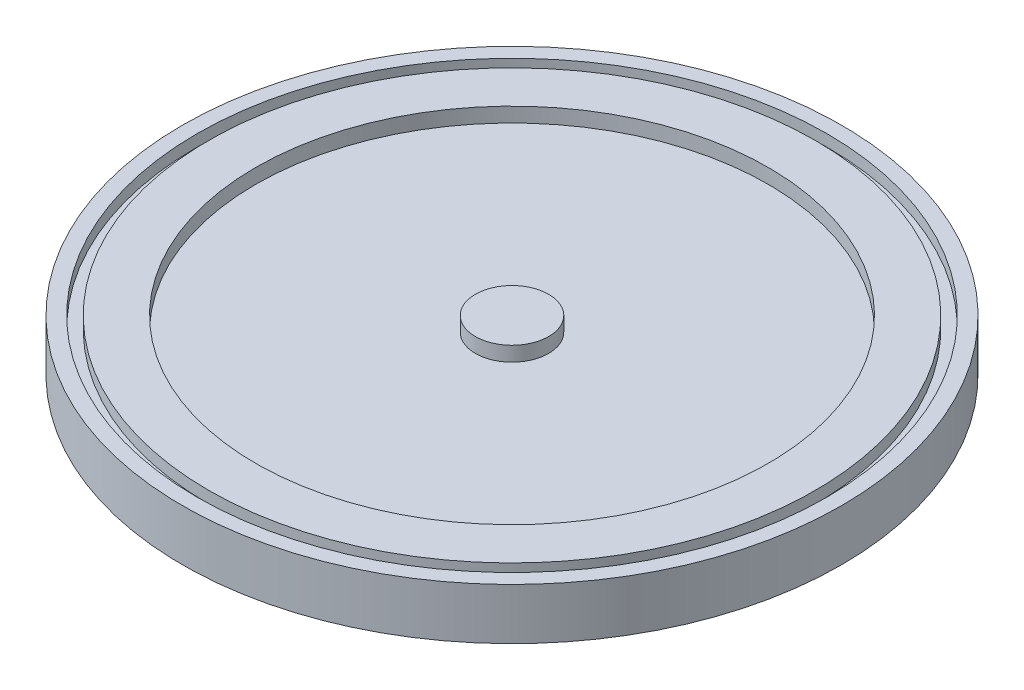
from build123d import *

# Parameters (mm, degrees)
O_RINGS_PROFILE_W = 2.032
O_RINGS_PROFILE_H = 2.032


with BuildPart() as part:
    # Main Shape Profile → Main Shape (revolve)
    with BuildSketch(Plane.XY, mode=Mode.PRIVATE) as main_shape_sk:
        Polygon((57.15, 0), (57.15, 8.89), (44.45, 8.89), (44.45, 6.35), (6.35, 6.35), (6.35, 8.89), (0, 8.89), (0, 0), align=None)
    revolve(main_shape_sk.sketch.rotate(Axis((0, 0, 0), (0, -1, 0)), 180), axis=Axis((0, 0, 0), (0, -1, 0)))

    # O Rings Profile → O-Rings Cutout (revolve, cut)
    with BuildSketch(Plane.XY, mode=Mode.PRIVATE) as o_rings_cutout_sk:
        with Locations((53.594, 7.874)):
            Rectangle(O_RINGS_PROFILE_W, O_RINGS_PROFILE_H)
        with Locations((53.594, 1.016)):
            Rectangle(O_RINGS_PROFILE_W, O_RINGS_PROFILE_H)
    revolve(o_rings_cutout_sk.sketch.rotate(Axis((0, 0, 0), (0, -1, 0)), 90), axis=Axis((0, 0, 0), (0, -1, 0)), mode=Mode.SUBTRACT)


solid = part.part
